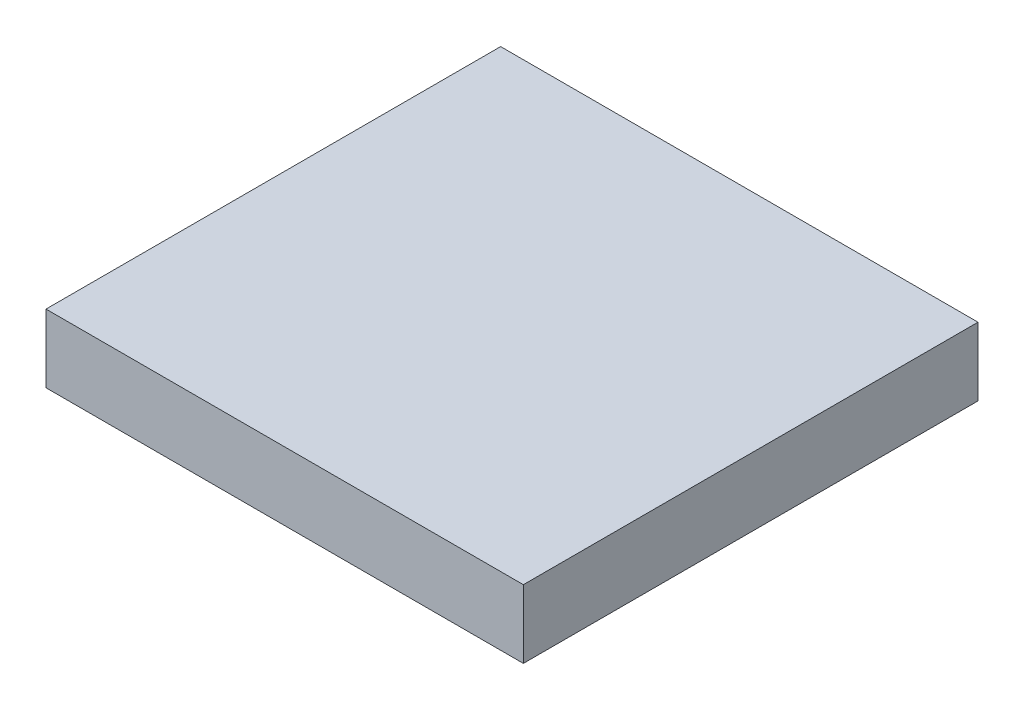
from build123d import *

# Parameters (mm, degrees)
SKETCH1_W           = 42
SKETCH1_H           = 40
BOSS_EXTRUDE1_DEPTH = 6


with BuildPart() as part:
    # Sketch1 → Boss-Extrude1 (new body)
    with BuildSketch(Plane(origin=(0, 0, 0), x_dir=(1, 0, 0), z_dir=(0, 1, 0))):
        Rectangle(SKETCH1_W, SKETCH1_H)
    extrude(amount=BOSS_EXTRUDE1_DEPTH)


solid = part.part
